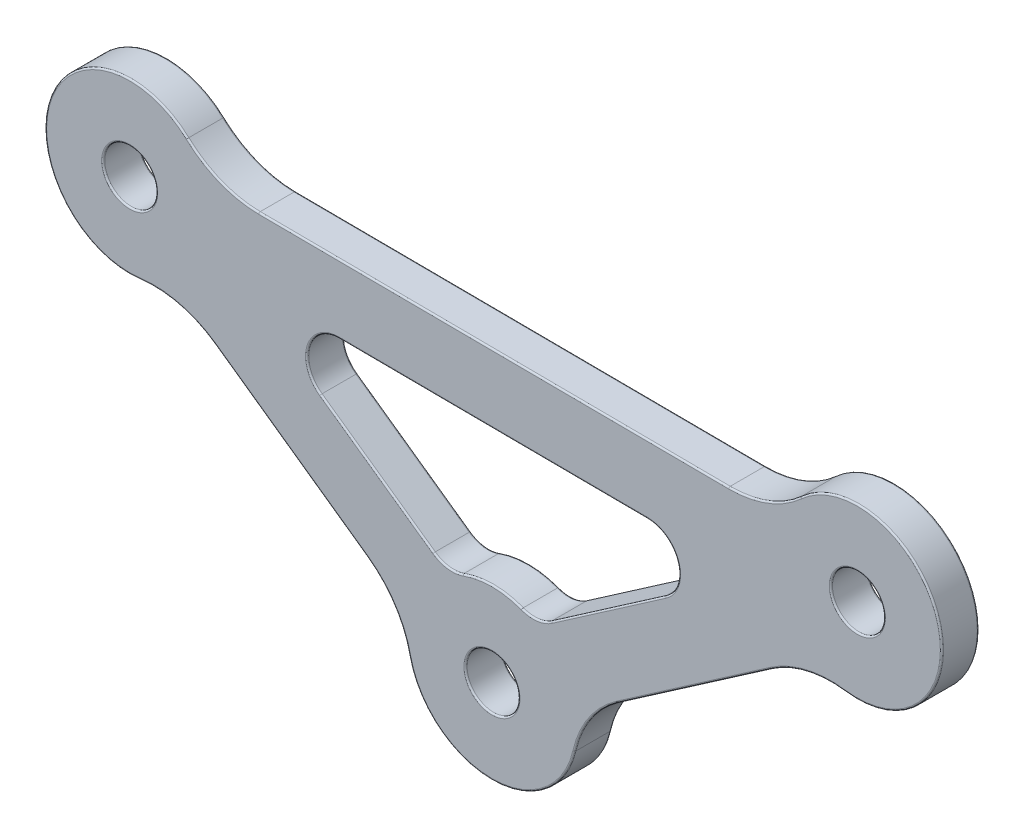
from build123d import *

# Parameters (mm, degrees)
SKETCH1_R             = 8
SKETCH1_R_2           = 2.5
BOSS_EXTRUDE1_DEPTH   = 3.5
BOSS_EXTRUDE1_2_DEPTH = 3.5
BOSS_EXTRUDE1_3_DEPTH = 3.5
EXTRUDE_THIN1_DEPTH   = 3.5
FILLET1_R             = 3
FILLET2_R             = 10
FILLET3_R             = 0.15


with BuildPart() as part:
    # Sketch1 → Boss-Extrude1 (new body)
    with BuildSketch(Plane.XY):
        with Locations((-91.128036754, 225.271869825)):
            Circle(SKETCH1_R)
        with Locations((-91.128036754, 225.271869825)):
            Circle(SKETCH1_R_2, mode=Mode.SUBTRACT)
    extrude(amount=BOSS_EXTRUDE1_DEPTH)



with BuildPart() as body_2:
    # Sketch1 → Boss-Extrude1 2 (new body)
    with BuildSketch(Plane.XY):
        with Locations((-22.320579288, 224.846590266)):
            Circle(SKETCH1_R)
        with Locations((-22.320579288, 224.846590266)):
            Circle(SKETCH1_R_2, mode=Mode.SUBTRACT)
    extrude(amount=BOSS_EXTRUDE1_2_DEPTH)


with BuildPart() as body_3:
    # Sketch1 → Boss-Extrude1 3 (new body)
    with BuildSketch(Plane.XY):
        with Locations((-56.873199998, 200.969479844)):
            Circle(SKETCH1_R)
        with Locations((-56.873199998, 200.969479844)):
            Circle(SKETCH1_R_2, mode=Mode.SUBTRACT)
    extrude(amount=BOSS_EXTRUDE1_3_DEPTH)


with BuildPart() as part_1:
    add(part.part)

    add(body_2.part)  # Extrude-Thin1 merges body 2

    add(body_3.part)  # Extrude-Thin1 merges body 3
    # Sketch2 → Extrude-Thin1 (add)
    with BuildSketch(Plane.XY.offset(3.5)):
        Polygon((-29.204221068, 228.139198198), (-84.204221068, 228.479137742), (-84.244394974, 221.979261893), (-29.244394974, 221.639322349), align=None)
        Polygon((-88.115030728, 219.149427936), (-63.647290188, 201.790577949), (-59.886206024, 207.091921733), (-84.353946565, 224.450771719), align=None)
        Polygon((-50.089477781, 201.706780921), (-25.409034417, 218.761859794), (-29.104301506, 224.109289189), (-53.78474487, 207.054210316), align=None)
    extrude(amount=-EXTRUDE_THIN1_DEPTH)

    # Fillet1
    fillet1_edges = [part_1.edges().sort_by_distance(p)[0] for p in [
        (-80.840637478, 221.958224224, 1.75),
        (-60.954708794, 207.849980258, 1.75),
        (-52.706953397, 207.799003199, 1.75),
        (-32.648152471, 221.660360017, 1.75),
    ]]
    fillet(fillet1_edges, radius=FILLET1_R)

    # Fillet2
    fillet2_edges = [part_1.edges().sort_by_distance(p)[0] for p in [
        (-83.797993666, 228.476626965, 1.75),
        (-29.61044847, 228.141708975, 1.75),
        (-87.046527958, 218.391369411, 1.75),
        (-64.715792958, 202.548636474, 1.75),
        (-49.011686308, 202.451573804, 1.75),
        (-26.486825889, 218.01706691, 1.75),
    ]]
    fillet(fillet2_edges, radius=FILLET2_R)

    # Fillet3
    fillet3_edges = [part_1.edges().sort_by_distance(p)[0] for p in [
        (-67.727899096, 212.655278654, 0),
        (-67.727899096, 212.655278654, 3.5),
        (-56.744394974, 221.809292121, 3.5),
        (-56.744394974, 221.809292121, 0),
        (-45.874882436, 212.520211299, 3.5),
        (-45.874882436, 212.520211299, 0),
        (-56.82375519, 208.969327043, 0),
        (-56.82375519, 208.969327043, 3.5),
        (-74.200097183, 219.819258239, 3.5),
        (-74.200097183, 219.819258239, 0),
        (-39.314625116, 219.603640939, 0),
        (-39.314625116, 219.603640939, 3.5),
        (-52.616077036, 208.279378945, 3.5),
        (-52.616077036, 208.279378945, 0),
        (-61.039640304, 208.331442623, 3.5),
        (-61.039640304, 208.331442623, 0),
        (-14.676121071, 227.205034363, 3.5),
        (-14.676121071, 227.205034363, 0),
        (-37.749256099, 210.234320357, 3.5),
        (-37.749256099, 210.234320357, 0),
        (-56.922644805, 192.969632645, 0),
        (-56.922644805, 192.969632645, 3.5),
        (-75.881160458, 210.470002942, 0),
        (-75.881160458, 210.470002942, 3.5),
        (-98.742758291, 227.724626624, 0),
        (-98.742758291, 227.724626624, 3.5),
        (-56.704221068, 228.30916797, 3.5),
        (-56.704221068, 228.30916797, 0),
        (-27.119442475, 216.749633091, 0),
        (-27.119442475, 216.749633091, 3.5),
        (-47.602438174, 202.595142346, 3.5),
        (-47.602438174, 202.595142346, 0),
        (-66.123158781, 202.709613716, 3.5),
        (-66.123158781, 202.709613716, 0),
        (-86.429626409, 217.116212671, 3.5),
        (-86.429626409, 217.116212671, 0),
        (-82.552814323, 229.151994001, 0),
        (-82.552814323, 229.151994001, 3.5),
        (-30.847184494, 228.832416033, 0),
        (-30.847184494, 228.832416033, 3.5),
        (-24.820579288, 224.846590266, 0),
        (-24.820579288, 224.846590266, 3.5),
        (-93.628036754, 225.271869825, 0),
        (-93.628036754, 225.271869825, 3.5),
        (-59.373199998, 200.969479844, 0),
        (-59.373199998, 200.969479844, 3.5),
    ]]
    fillet(fillet3_edges, radius=FILLET3_R)


solid = part_1.part
